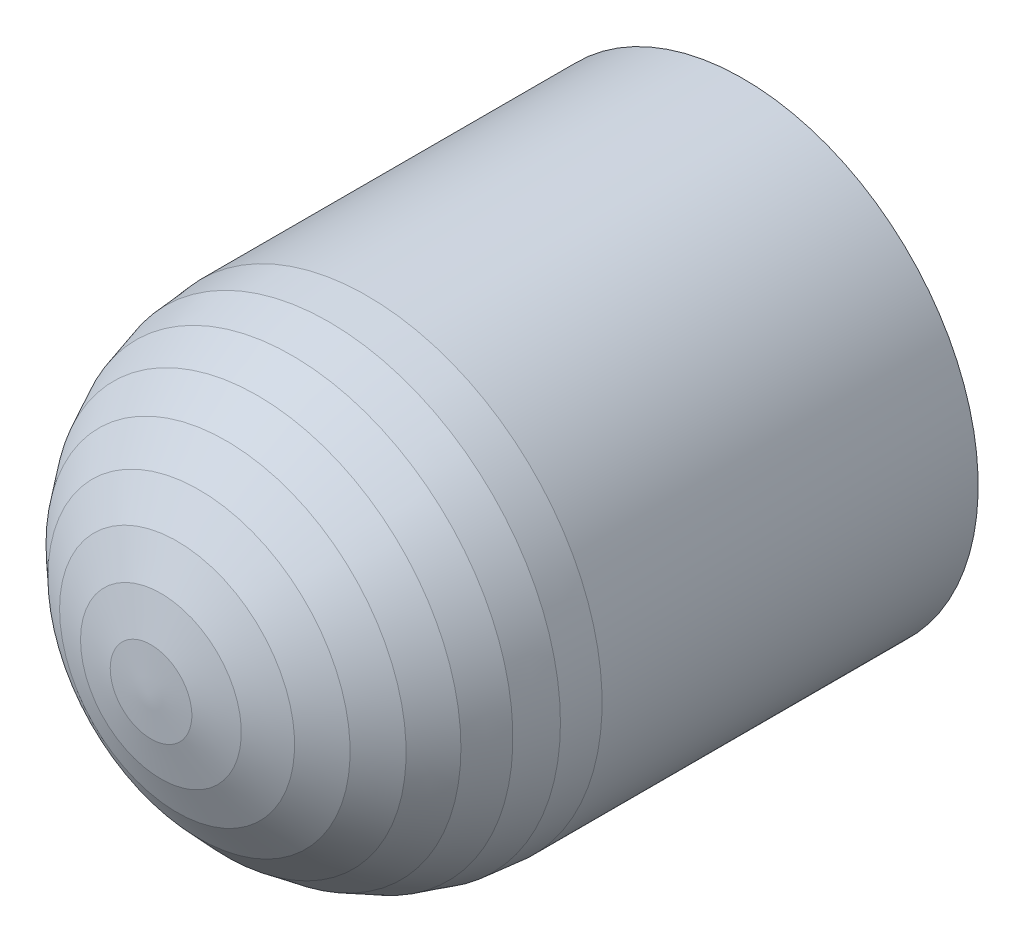
from build123d import *


with BuildPart() as part:
    # Sketch1 → Revolve1 (revolve)
    with BuildSketch(Plane(origin=(0, 0, 0), x_dir=(-1, 0, 0), z_dir=(0, 1, 0)), mode=Mode.PRIVATE) as revolve1_sk:
        Polygon((0, 0), (-75, 0), (-75, 120), (-73.860581476, 132.155372437), (-70.476946559, 143.941410033), (-64.951905284, 155), (-57.453333234, 164.995132678), (-48.209070726, 173.623111018), (-37.5, 180.621778265), (-25.651510749, 185.778483455), (-13.023613325, 188.936542711), (0, 190), align=None)
    revolve(revolve1_sk.sketch.rotate(Axis((0, 0, -10), (0, 0, 1)), 180), axis=Axis((0, 0, -10), (0, 0, 1)))


solid = part.part
